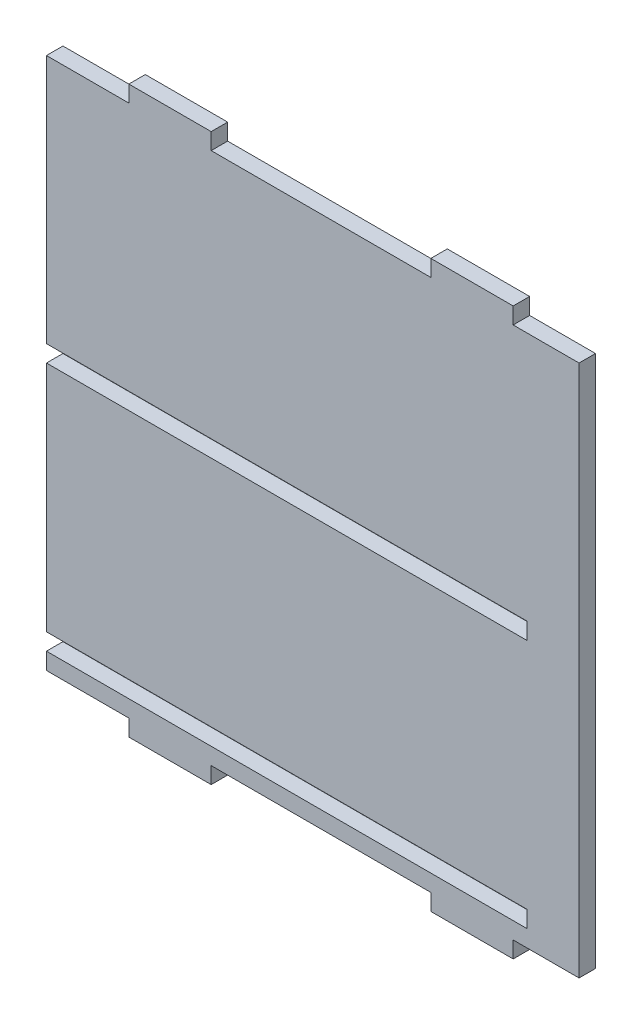
from build123d import *

# Parameters (mm, degrees)
RESSALTO_EXTRUS_O1_DEPTH = 6
ESBO_O2_W                = 175
ESBO_O2_H                = 6.1
CORTE_EXTRUS_O1_DEPTH    = 10


with BuildPart() as part:
    # Esboço1 → Ressalto-extrusão1 (new body)
    with BuildSketch(Plane.XY):
        Polygon((-67, -97), (-97, -97), (-97, 97), (-67, 97), (-67, 103), (-37, 103), (-37, 97), (43, 97), (43, 103), (73, 103), (73, 97), (97, 97), (97, -97), (73, -97), (73, -103), (43, -103), (43, -97), (-37, -97), (-37, -103), (-67, -103), align=None)
    extrude(amount=RESSALTO_EXTRUS_O1_DEPTH)

    # Esboço2 → Corte-extrusão1 (cut)
    with BuildSketch(Plane.XY.offset(6)):
        with Locations((-9.5, 3.05)):
            Rectangle(ESBO_O2_W, ESBO_O2_H)
        with Locations((-9.5, -87.85)):
            Rectangle(ESBO_O2_W, ESBO_O2_H)
    extrude(amount=-CORTE_EXTRUS_O1_DEPTH, mode=Mode.SUBTRACT)


solid = part.part
